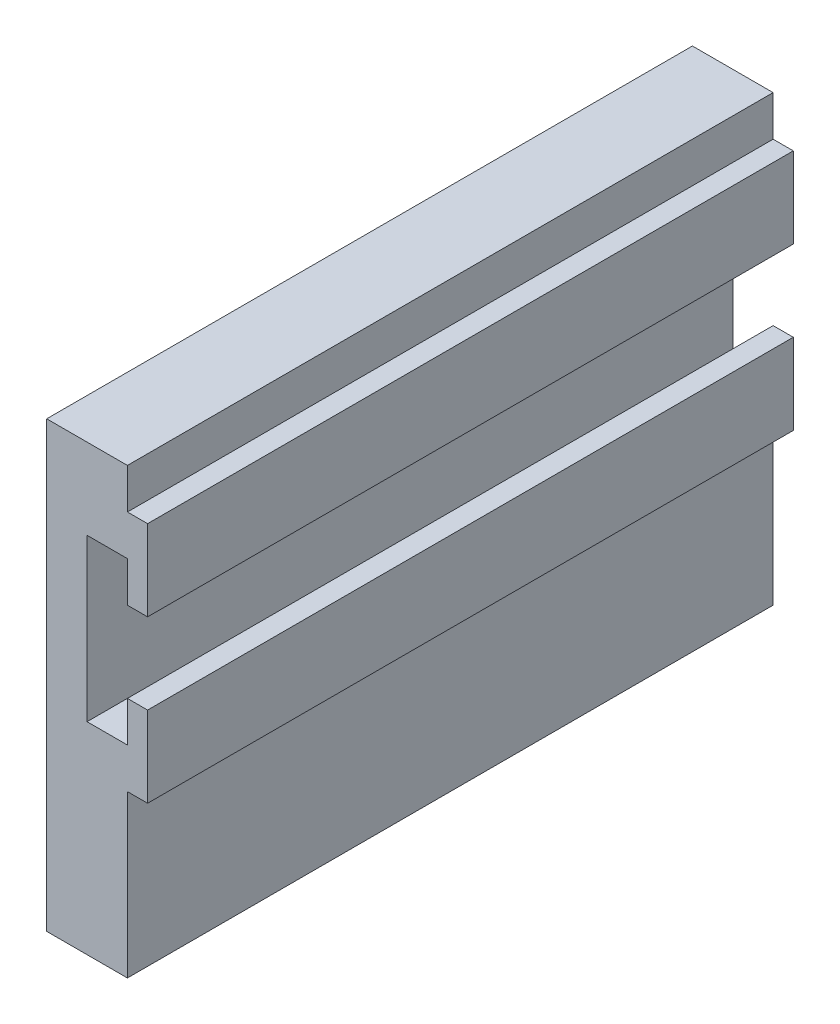
from build123d import *

# Parameters (mm, degrees)
BOSS_EXTRUDE1_DEPTH      = 160
SKETCH2_W                = 20
SKETCH2_H                = 160
BOSS_EXTRUDE2_DEPTH      = 30
BOSS_EXTRUDE3_DEPTH      = 10
BOSS_EXTRUDE3_DEPTH_BACK = 10
SKETCH3_W                = 5
SKETCH3_H                = 160
BOSS_EXTRUDE4_DEPTH      = 10
BOSS_EXTRUDE4_DEPTH_BACK = 10
SKETCH4_W                = 5
SKETCH4_H                = 160


with BuildPart() as part:
    # Sketch1 → Boss-Extrude1 (new body)
    with BuildSketch(Plane.XY):
        Polygon((0, 0), (20, 0), (20, 20), (10, 20), (10, 60), (20, 60), (20, 80), (0, 80), align=None)
    extrude(amount=BOSS_EXTRUDE1_DEPTH)

    # Sketch2 → Boss-Extrude2 (add)
    with BuildSketch(Plane.XZ):
        with Locations((10, 80)):
            Rectangle(SKETCH2_W, SKETCH2_H)
    extrude(amount=BOSS_EXTRUDE2_DEPTH)

    # Sketch3 → Boss-Extrude3 (add, two sides: drawn at the far end of the back side and taken through both)
    with BuildSketch(Plane(origin=(0, 20, 0), x_dir=(1, 0, 0), z_dir=(0, 1, 0)).offset(-BOSS_EXTRUDE3_DEPTH_BACK)):
        with Locations((22.5, -80)):
            Rectangle(SKETCH3_W, SKETCH3_H)
    extrude(amount=BOSS_EXTRUDE3_DEPTH + BOSS_EXTRUDE3_DEPTH_BACK)

    # Sketch4 → Boss-Extrude4 (add, two sides: drawn at the far end of the back side and taken through both)
    with BuildSketch(Plane.XZ.offset(-60).offset(-BOSS_EXTRUDE4_DEPTH_BACK)):
        with Locations((22.5, 80)):
            Rectangle(SKETCH4_W, SKETCH4_H)
    extrude(amount=BOSS_EXTRUDE4_DEPTH + BOSS_EXTRUDE4_DEPTH_BACK)


solid = part.part
